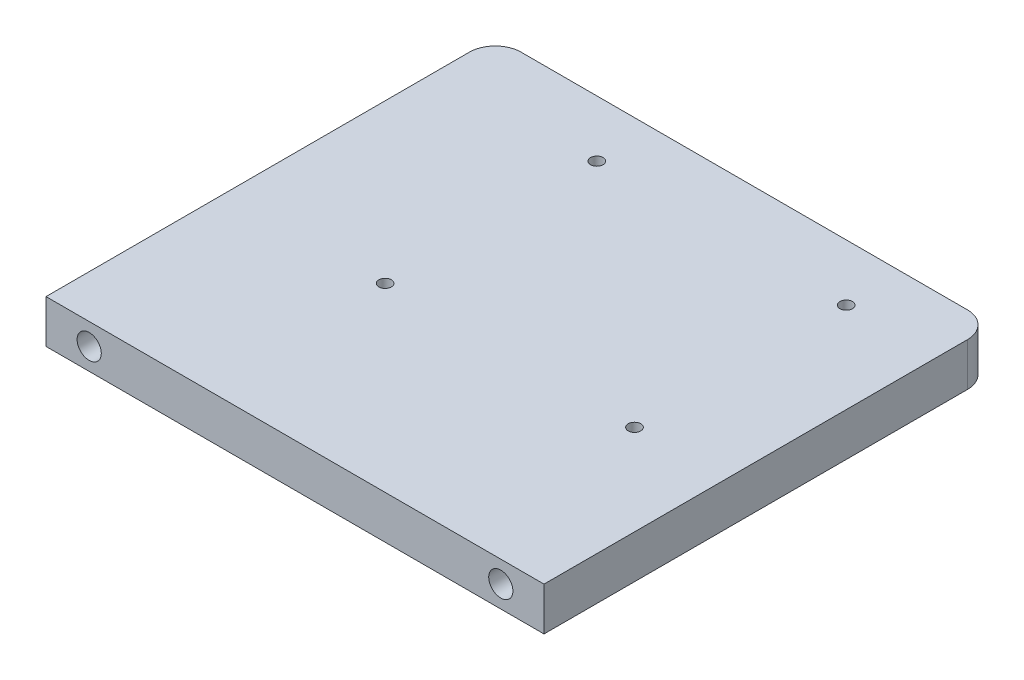
from build123d import *

# Parameters (mm, degrees)
SKETCH2_W                                         = 115.292618629
SKETCH2_H                                         = 134.000000002
BOSS_EXTRUDE2_DEPTH                               = 8
FILLET2_R                                         = 6
SKETCH19_W                                        = 8
SKETCH19_H                                        = 99
BOSS_EXTRUDE3_DEPTH                               = 115.292618629
SKETCH21_W                                        = 135.292618629
SKETCH21_H                                        = 129
SKETCH21_W_2                                      = 115.292618629
SKETCH21_H_2                                      = 99
BOSS_EXTRUDE4_DEPTH                               = 8
FILLET3_R                                         = 5
CUT_EXTRUDE1_DEPTH                                = 4
SKETCH24_W                                        = 115.292618629
SKETCH24_H                                        = 10
BOSS_EXTRUDE5_DEPTH                               = 104
FILLET4_R                                         = 6
CSK_FOR_M2_5_FLAT_HEAD_MACHINE_SCREW2_D           = 2.9
CSK_FOR_M2_5_FLAT_HEAD_MACHINE_SCREW2_DEPTH       = 10
CSK_FOR_M2_5_FLAT_HEAD_MACHINE_SCREW2_CSINK_D     = 5.5
CSK_FOR_M2_5_FLAT_HEAD_MACHINE_SCREW2_CSINK_ANGLE = 90
SKETCH49_R                                        = 4.43
CUT_EXTRUDE3_DEPTH                                = 8
M2_5_CLEARANCE_HOLE1_D                            = 2.9
CUT_EXTRUDE4_START                                = -8
CUT_EXTRUDE4_DEPTH                                = 8
CHAMFER1_SIZE                                     = 0.9
SKETCH62_W                                        = 134.000000002
SKETCH62_H                                        = 8
CUT_EXTRUDE5_DEPTH                                = 115.292618629
SKETCH63_W                                        = 135.292618629
SKETCH63_H                                        = 8
CUT_EXTRUDE6_DEPTH                                = 129
F_5_6_5_6_DIAMETER_HOLE1_D                        = 5.6
F_5_6_5_6_DIAMETER_HOLE1_DEPTH                    = 8
F_5_6_5_6_DIAMETER_HOLE1_TIP                      = 1.682409733


with BuildPart() as part:
    # Sketch2 → Boss-Extrude2 (new body)
    with BuildSketch(Plane(origin=(0, 0, 0), x_dir=(1, 0, 0), z_dir=(0, 1, 0))):
        with Locations((4.853690686, 42.889279439)):
            Rectangle(SKETCH2_W, SKETCH2_H)
    extrude(amount=BOSS_EXTRUDE2_DEPTH)

    # Fillet2
    fillet2_edges = [part.edges().sort_by_distance(p)[0] for p in [
        (-52.792618629, 4, -109.88927944),
        (62.5, 4, -109.88927944),
    ]]
    fillet(fillet2_edges, radius=FILLET2_R)

    # Sketch19 → Boss-Extrude3 (add)
    with BuildSketch(Plane.ZY.offset(52.792618629)):
        with Locations((28.110720562, 13.5)):
            Rectangle(SKETCH19_W, SKETCH19_H)
    extrude(amount=-BOSS_EXTRUDE3_DEPTH)

    # Sketch21 → Boss-Extrude4 (add)
    with BuildSketch(Plane.XY.offset(32.110720562)):
        with Locations((4.853690685, 8.5)):
            Rectangle(SKETCH21_W, SKETCH21_H)
        with Locations((4.853690686, 13.5)):
            Rectangle(SKETCH21_W_2, SKETCH21_H_2, mode=Mode.SUBTRACT)
    extrude(amount=-BOSS_EXTRUDE4_DEPTH)

    # Fillet3
    fillet3_edges = [part.edges().sort_by_distance(p)[0] for p in [
        (72.5, 73, 28.110720562),
        (72.5, -56, 28.110720562),
        (-62.792618629, -56, 28.110720562),
        (-62.792618629, 73, 28.110720562),
    ]]
    fillet(fillet3_edges, radius=FILLET3_R)

    # Sketch22 → Cut-Extrude1 (cut)
    with BuildSketch(Plane(origin=(0, 0, 24.110720562), x_dir=(-1, 0, 0), z_dir=(0, 0, -1))):
        with BuildLine():
            Line((62.792618629, -51), (62.792618629, 68))
            ThreePointArc((62.792618629, 68), (61.328152535, 71.535533906), (57.792618629, 73))
            Line((57.792618629, 73), (-67.5, 73))
            ThreePointArc((-67.5, 73), (-71.035533906, 71.535533906), (-72.5, 68))
            Line((-72.5, 68), (-72.5, -51))
            ThreePointArc((-72.5, -51), (-71.035533906, -54.535533906), (-67.5, -56))
            Line((-67.5, -56), (57.792618629, -56))
            ThreePointArc((57.792618629, -56), (61.328152535, -54.535533906), (62.792618629, -51))
        make_face()
        with BuildLine():
            Line((57.792618629, 69.75), (-67.5, 69.75))
            ThreePointArc((-67.5, 69.75), (-68.737436867, 69.237436867), (-69.25, 68))
            Line((-69.25, 68), (-69.25, -51))
            ThreePointArc((-69.25, -51), (-68.737436867, -52.237436867), (-67.5, -52.75))
            Line((-67.5, -52.75), (57.792618629, -52.75))
            ThreePointArc((57.792618629, -52.75), (59.030055496, -52.237436867), (59.542618629, -51))
            Line((59.542618629, -51), (59.542618629, 68))
            ThreePointArc((59.542618629, 68), (59.030055496, 69.237436867), (57.792618629, 69.75))
        make_face(mode=Mode.SUBTRACT)
    extrude(amount=-CUT_EXTRUDE1_DEPTH, mode=Mode.SUBTRACT)

    # Sketch24 → Boss-Extrude5 (add)
    with BuildSketch(Plane(origin=(0, 0, 24.110720562), x_dir=(-1, 0, 0), z_dir=(0, 0, -1))):
        with Locations((-4.853690686, 60)):
            Rectangle(SKETCH24_W, SKETCH24_H)
    extrude(amount=BOSS_EXTRUDE5_DEPTH)

    # Fillet4
    fillet4_edges = [part.edges().sort_by_distance(p)[0] for p in [
        (62.5, 60, -79.889279438),
        (-52.792618629, 60, -79.889279438),
    ]]
    fillet(fillet4_edges, radius=FILLET4_R)

    # CSK for M2.5 Flat Head Machine Screw2
    with Locations(Plane(origin=(0, 55, 0), x_dir=(-1, 0, 0), z_dir=(0, -1, 0))):
        with Locations((16.187618629, 66.799279438), (-41.542381371, 66.799279438), (16.187618629, 17.789279438), (-41.542381371, 17.789279438)):
            CounterSinkHole(CSK_FOR_M2_5_FLAT_HEAD_MACHINE_SCREW2_D / 2, CSK_FOR_M2_5_FLAT_HEAD_MACHINE_SCREW2_CSINK_D / 2, depth=CSK_FOR_M2_5_FLAT_HEAD_MACHINE_SCREW2_DEPTH, counter_sink_angle=CSK_FOR_M2_5_FLAT_HEAD_MACHINE_SCREW2_CSINK_ANGLE)

    # Sketch49 → Cut-Extrude3 (cut)
    with BuildSketch(Plane.XY.offset(32.110720562)):
        with Locations((4.853690685, 40.159632183)):
            Circle(SKETCH49_R)
    extrude(amount=-CUT_EXTRUDE3_DEPTH, mode=Mode.SUBTRACT)

    # M2.5 Clearance Hole1 (through all)
    with Locations(Plane(origin=(0, 8, 0), x_dir=(1, 0, 0), z_dir=(0, 1, 0))):
        with Locations((-28.27, 101.64), (-7.29, 101.64), (-7.29, 88.14), (-28.27, 88.14)):
            Hole(M2_5_CLEARANCE_HOLE1_D / 2)

    # Sketch60 → Cut-Extrude4 (cut)
    with BuildSketch(Plane(origin=(0, 8, 0), x_dir=(1, 0, 0), z_dir=(0, 1, 0)).offset(CUT_EXTRUDE4_START)):
        with BuildLine():
            Line((-30.27, 103.09), (-26.27, 103.09))
            ThreePointArc((-26.27, 103.09), (-24.82, 101.64), (-26.27, 100.19))
            Line((-26.27, 100.19), (-30.27, 100.19))
            ThreePointArc((-30.27, 100.19), (-31.72, 101.64), (-30.27, 103.09))
        make_face()
        with BuildLine():
            Line((-9.29, 103.09), (-5.29, 103.09))
            ThreePointArc((-5.29, 103.09), (-3.84, 101.64), (-5.29, 100.19))
            Line((-5.29, 100.19), (-9.29, 100.19))
            ThreePointArc((-9.29, 100.19), (-10.74, 101.64), (-9.29, 103.09))
        make_face()
        with BuildLine():
            Line((-30.27, 89.59), (-26.27, 89.59))
            ThreePointArc((-26.27, 89.59), (-24.82, 88.14), (-26.27, 86.69))
            Line((-26.27, 86.69), (-30.27, 86.69))
            ThreePointArc((-30.27, 86.69), (-31.72, 88.14), (-30.27, 89.59))
        make_face()
        with BuildLine():
            Line((-9.29, 89.59), (-5.29, 89.59))
            ThreePointArc((-5.29, 89.59), (-3.84, 88.14), (-5.29, 86.69))
            Line((-5.29, 86.69), (-9.29, 86.69))
            ThreePointArc((-9.29, 86.69), (-10.74, 88.14), (-9.29, 89.59))
        make_face()
    extrude(amount=CUT_EXTRUDE4_DEPTH, mode=Mode.SUBTRACT)

    # Chamfer1
    chamfer1_edges = [part.edges().sort_by_distance(p)[0] for p in [
        (-7.29, 8, -100.19),
        (-3.84, 8, -101.64),
        (-7.29, 8, -103.09),
        (-28.27, 8, -86.69),
        (-24.82, 8, -88.14),
        (-28.27, 8, -89.59),
        (-7.29, 8, -86.69),
        (-3.84, 8, -88.14),
        (-7.29, 8, -89.59),
        (-28.27, 8, -103.09),
        (-31.72, 8, -101.64),
        (-28.27, 8, -100.19),
        (-24.82, 8, -101.64),
        (-10.74, 8, -88.14),
        (-31.72, 8, -88.14),
        (-10.74, 8, -101.64),
    ]]
    chamfer(chamfer1_edges, length=CHAMFER1_SIZE)

    # Sketch62 → Cut-Extrude5 (cut)
    with BuildSketch(Plane.ZY.offset(52.792618629)):
        with Locations((-42.889279439, 4)):
            Rectangle(SKETCH62_W, SKETCH62_H)
    extrude(amount=-CUT_EXTRUDE5_DEPTH, mode=Mode.SUBTRACT)

    # Sketch63 → Cut-Extrude6 (cut)
    with BuildSketch(Plane(origin=(0, 73, 0), x_dir=(1, 0, 0), z_dir=(0, 1, 0))):
        with Locations((4.853690685, -28.110720562)):
            Rectangle(SKETCH63_W, SKETCH63_H)
    extrude(amount=-CUT_EXTRUDE6_DEPTH, mode=Mode.SUBTRACT)

    # Ø5.6 (5.6) Diameter Hole1
    with Locations(Plane.XY.offset(24.110720562)):
        with Locations((-42.792618629, 60), (52.5, 60)):
            Hole(F_5_6_5_6_DIAMETER_HOLE1_D / 2, depth=F_5_6_5_6_DIAMETER_HOLE1_DEPTH)
            with Locations((0, 0, -(F_5_6_5_6_DIAMETER_HOLE1_DEPTH + F_5_6_5_6_DIAMETER_HOLE1_TIP / 2))):  # 118° drill point
                Cone(0, F_5_6_5_6_DIAMETER_HOLE1_D / 2, F_5_6_5_6_DIAMETER_HOLE1_TIP, mode=Mode.SUBTRACT)


solid = part.part
